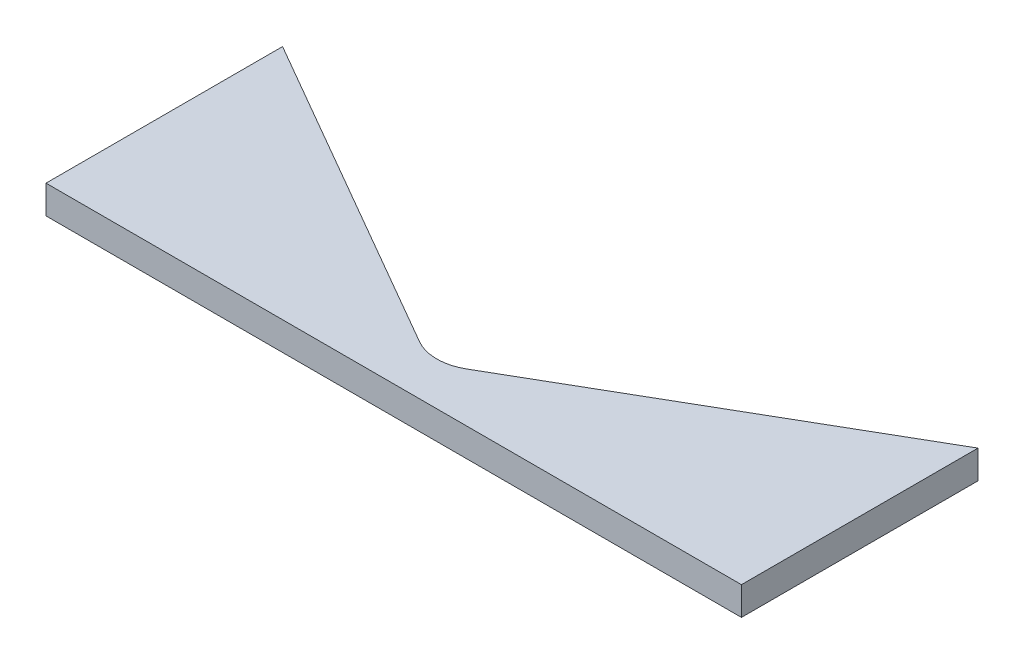
from build123d import *

# Parameters (mm, degrees)
BOSS_EXTRUDE1_DEPTH = 19.05


with BuildPart() as part:
    # Sketch1 → Boss-Extrude1 (new body)
    with BuildSketch(Plane(origin=(0, 0, 0), x_dir=(1, 0, 0), z_dir=(0, 1, 0))):
        with BuildLine():
            Line((-233.3625, 0), (233.3625, 0))
            Line((233.3625, 0), (233.3625, 158.75))
            Line((233.3625, 158.75), (15.875, 33.18353333))
            ThreePointArc((15.875, 33.18353333), (0, 28.9298399), (-15.875, 33.18353333))
            Line((-15.875, 33.18353333), (-233.3625, 158.75))
            Line((-233.3625, 158.75), (-233.3625, 0))
        make_face()
    extrude(amount=BOSS_EXTRUDE1_DEPTH)


solid = part.part
